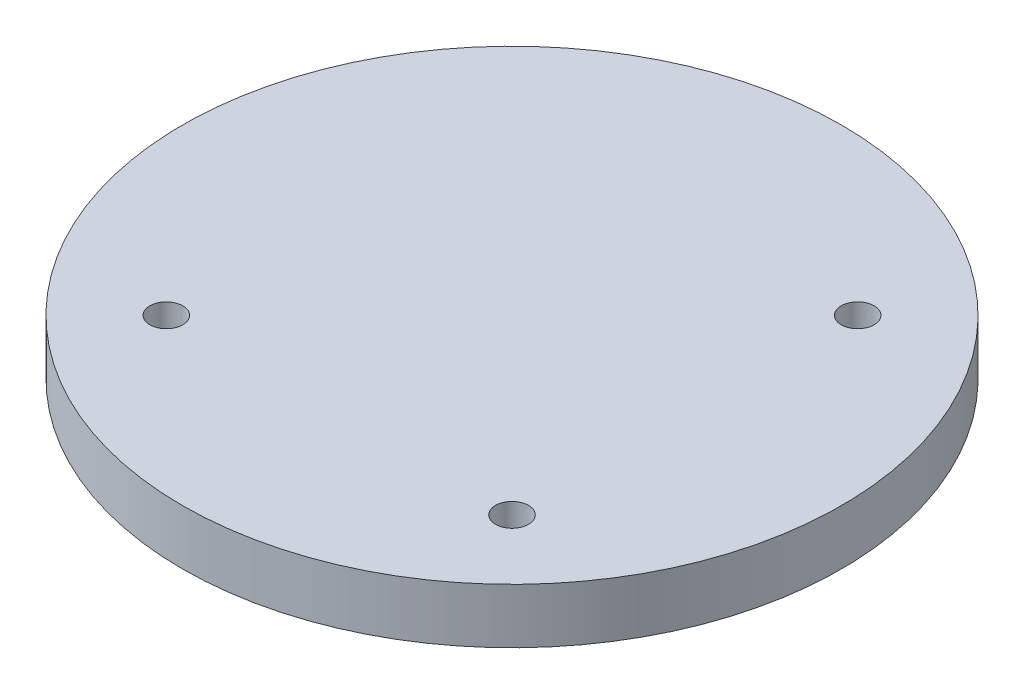
from build123d import *

# Parameters (mm, degrees)
SKETCH1_R                = 30
BOSS_EXTRUDE1_DEPTH      = 5
F_3_0_3_DIAMETER_HOLE1_D = 3


with BuildPart() as part:
    # Sketch1 → Boss-Extrude1 (new body)
    with BuildSketch(Plane(origin=(0, 0, 0), x_dir=(1, 0, 0), z_dir=(0, 1, 0))):
        with Locations(Location((0, 0, 0), (0, 0, 270))):
            Circle(SKETCH1_R)
    extrude(amount=BOSS_EXTRUDE1_DEPTH)

    # Ø3.0 (3) Diameter Hole1 (through all)
    with Locations(Plane(origin=(0, 5, 0), x_dir=(1, 0, 0), z_dir=(0, 1, 0))):
        with Locations((-15.733125881, -15.733125881), (15.733125881, -15.733125881), (15.733125881, 15.733125881)):
            Hole(F_3_0_3_DIAMETER_HOLE1_D / 2)


solid = part.part
